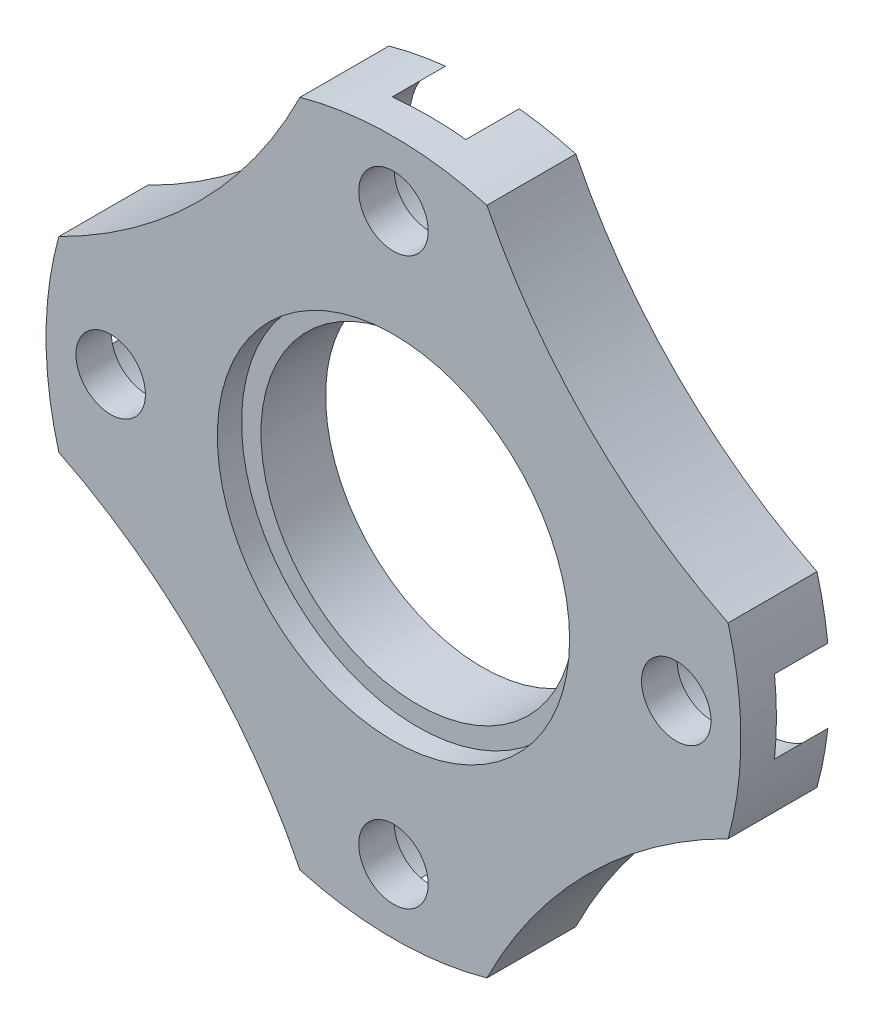
from build123d import *

# Parameters (mm, degrees)
SKETCH_1_R          = 21.5
SKETCH_1_R_2        = 2.15
SKETCH_1_R_3        = 9.7
EXTRUDE_1_DEPTH     = 5.5
SKETCH_2_R          = 10.9
SKETCH_2_R_2        = 9.55
CUT_EXTRUDE_1_DEPTH = 1.5
CUT_EXTRUDE_2_DEPTH = 31.899029111
SKETCH_4_R          = 4.5
CUT_EXTRUDE_3_DEPTH = 3.3


with BuildPart() as part:
    # 草图1 → 凸台-拉伸1 (new body)
    with BuildSketch(Plane.XY):
        Circle(SKETCH_1_R)
        with Locations((0, 17.5)):
            Circle(SKETCH_1_R_2, mode=Mode.SUBTRACT)
        with Locations((17.5, 0)):
            Circle(SKETCH_1_R_2, mode=Mode.SUBTRACT)
        with Locations((-17.5, 0)):
            Circle(SKETCH_1_R_2, mode=Mode.SUBTRACT)
        with Locations((0, -17.5)):
            Circle(SKETCH_1_R_2, mode=Mode.SUBTRACT)
        Circle(SKETCH_1_R_3, mode=Mode.SUBTRACT)
    extrude(amount=EXTRUDE_1_DEPTH)

    # 草图2 → 切除-拉伸1 (cut)
    with BuildSketch(Plane.XY.offset(5.5)):
        Circle(SKETCH_2_R)
        Circle(SKETCH_2_R_2, mode=Mode.SUBTRACT)
    extrude(amount=-CUT_EXTRUDE_1_DEPTH, mode=Mode.SUBTRACT)

    # 草图3 → 切除-拉伸2 (cut, through all)
    with BuildSketch(Plane.XY.offset(5.5)):
        with BuildLine():
            ThreePointArc((5.784529249, 20.707226308), (12.02081528, 12.02081528), (20.707226308, 5.784529249))
            ThreePointArc((20.707226308, 5.784529249), (15.202795796, 15.202795796), (5.784529249, 20.707226308))
        make_face()
        with BuildLine():
            ThreePointArc((-20.707226308, 5.784529249), (-12.02081528, 12.02081528), (-5.784529249, 20.707226308))
            ThreePointArc((-5.784529249, 20.707226308), (-15.202795796, 15.202795796), (-20.707226308, 5.784529249))
        make_face()
        with BuildLine():
            ThreePointArc((-5.784529249, -20.707226308), (-12.02081528, -12.02081528), (-20.707226308, -5.784529249))
            ThreePointArc((-20.707226308, -5.784529249), (-15.202795796, -15.202795796), (-5.784529249, -20.707226308))
        make_face()
        with BuildLine():
            ThreePointArc((20.707226308, -5.784529249), (12.02081528, -12.02081528), (5.784529249, -20.707226308))
            ThreePointArc((5.784529249, -20.707226308), (15.202795796, -15.202795796), (20.707226308, -5.784529249))
        make_face()
    extrude(amount=-CUT_EXTRUDE_2_DEPTH, mode=Mode.SUBTRACT)

    # 草图4 → 切除-拉伸3 (cut)
    with BuildSketch(Plane(origin=(0, 0, 0), x_dir=(-1, 0, 0), z_dir=(0, 0, -1))):
        with Locations((0, 17.5)):
            Circle(SKETCH_4_R)
        with Locations((17.5, 0)):
            Circle(SKETCH_4_R)
        with Locations((-17.5, 0)):
            Circle(SKETCH_4_R)
        with Locations((0, -17.5)):
            Circle(SKETCH_4_R)
    extrude(amount=-CUT_EXTRUDE_3_DEPTH, mode=Mode.SUBTRACT)


solid = part.part
